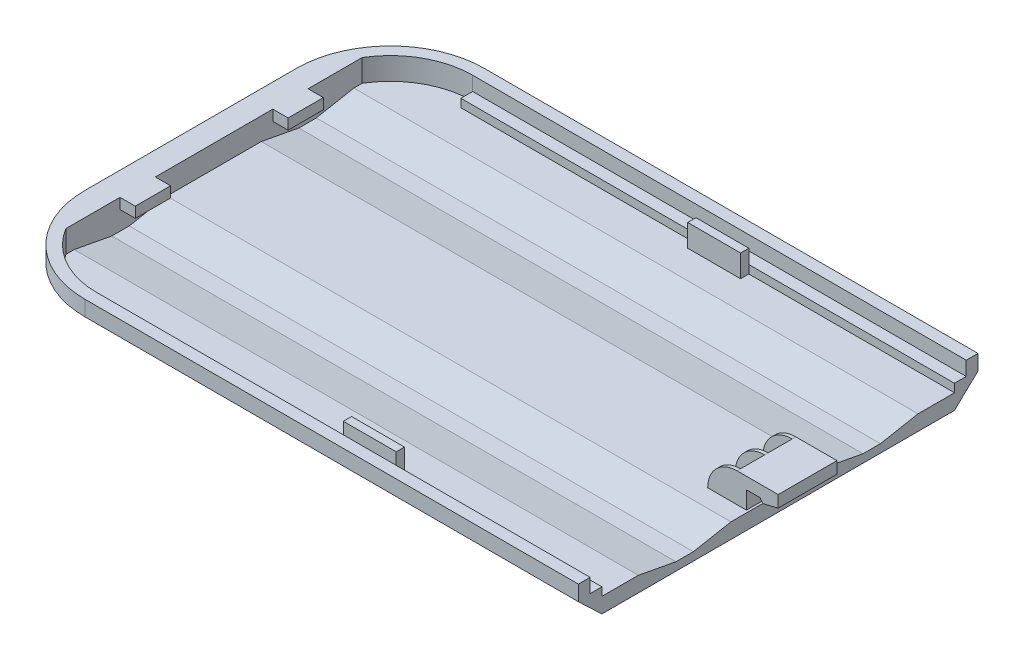
from build123d import *

# Parameters (mm, degrees)
BOSS_EXTRUDE1_DEPTH     = 42
SKETCH3_W               = 4.5
SKETCH3_H               = 0.7
BOSS_EXTRUDE2_DEPTH     = 1.899999
SKETCH6_W               = 2.500000024
SKETCH6_H               = 0.3
REVOLVE1_ANGLE          = 90
SKETCH7_W               = 2.7
SKETCH7_H               = 5
BOSS_EXTRUDE3_DEPTH     = 2.50000008
SKETCH9_W               = 3.499999976
SKETCH9_H               = 5
CUT_EXTRUDE1_DEPTH      = 1.50000008
SKETCH10_W              = 0.3
SKETCH10_H              = 5
REVOLVE2_ANGLE          = 90
BOSS_EXTRUDE5_START     = -5
BOSS_EXTRUDE5_DEPTH     = 5
REVOLVE4_ANGLE          = 90
REVOLVE6_ANGLE          = 90
BOSS_EXTRUDE7_DEPTH     = 18
BOSS_EXTRUDE8_DEPTH     = 2.9
CUT_EXTRUDE2_DEPTH      = 2.9
BOSS_EXTRUDE9_START     = -1.899999
BOSS_EXTRUDE9_DEPTH     = 1.899999
SKETCH29_W              = 3
SKETCH29_H              = 0.9
BOSS_EXTRUDE10_DEPTH    = 1.3
CUT_EXTRUDE3_START      = -3.1
CUT_EXTRUDE3_DEPTH      = 3.1
CUT_EXTRUDE4_START      = -44.9
CUT_EXTRUDE4_DEPTH      = 2.9
SKETCH34_W              = 0.799999976
SKETCH34_H              = 5
BOSS_EXTRUDE11_DEPTH    = 2.5
CUT_EXTRUDE5_DEPTH      = 53.947521022
CUT_EXTRUDE5_DEPTH_BACK = 12.7


with BuildPart() as part:
    # Sketch1 → Boss-Extrude1 (new body)
    with BuildSketch(Plane(origin=(0, 0, 0), x_dir=(0, 0, -1), z_dir=(1, 0, 0))):
        Polygon((-4.017828461, 1.2999976), (4.017828461, 1.2999976), (7.217828411, 0.69999753), (8.7, 0.69999753), (11.9, 1.2999976), (15, 1.2999976), (15, 1.9999962), (16, 1.9999962), (16, 3.1999962), (17, 3.1999962), (17, 1.8999962), (15, 0), (-15, 0), (-17, 1.8999962), (-17, 3.1999962), (-16, 3.1999962), (-16, 1.9999962), (-15, 1.9999962), (-15, 1.2999976), (-11.9, 1.2999976), (-8.7, 0.69999753), (-7.217828411, 0.69999753), align=None)
    extrude(amount=-BOSS_EXTRUDE1_DEPTH)

    # Sketch3 → Boss-Extrude2 (add)
    with BuildSketch(Plane(origin=(0, 1.2999976, 0), x_dir=(1, 0, 0), z_dir=(0, 1, 0))):
        with Locations((-19.75, 14.65)):
            Rectangle(SKETCH3_W, SKETCH3_H)
        with Locations((-19.75, -14.65)):
            Rectangle(SKETCH3_W, SKETCH3_H)
    extrude(amount=BOSS_EXTRUDE2_DEPTH)

    # Sketch6 → Revolve1 (revolve)
    with BuildSketch(Plane(origin=(0, 1.2999976, 0), x_dir=(1, 0, 0), z_dir=(0, 1, 0))):
        with Locations((-2.249999988, 2.35)):
            Rectangle(SKETCH6_W, SKETCH6_H)
        with Locations((-2.249999988, 0)):
            Rectangle(SKETCH6_W, SKETCH6_H)
        with Locations((-2.249999988, -2.35)):
            Rectangle(SKETCH6_W, SKETCH6_H)
    revolve(axis=Axis((-0.999999976, 1.2999976, -2.5), (0, 0, -1)), revolution_arc=REVOLVE1_ANGLE)

    # Sketch20 → Revolve4 (revolve)
    with BuildSketch(Plane.ZY.offset(42)):
        Polygon((17, 3.1999962), (17, 1.8999962), (15, 0), (9, 0), (9, 0.756247537), (11.9, 0.756247537), (11.9, 1.2999976), (15, 1.2999976), (16, 1.2999976), (16, 1.9999962), (16, 3.1999962), align=None)
    revolve(axis=Axis((-42, 0, 9), (0, -1, 0)), revolution_arc=REVOLVE4_ANGLE)

    # Sketch22 → Revolve6 (revolve)
    with BuildSketch(Plane.ZY.offset(42)):
        Polygon((-9, 0.756247537), (-9, 0), (-15, 0), (-17, 1.8999962), (-17, 3.1999962), (-16, 3.1999962), (-16, 1.9999962), (-16, 1.2999976), (-15, 1.2999976), (-11.9, 1.2999976), (-11.9, 0.756247537), align=None)
    revolve(axis=Axis((-42, 3.1999962, -9), (0, 1, 0)), revolution_arc=REVOLVE6_ANGLE)

    # Sketch25 → Boss-Extrude7 (add)
    with BuildSketch(Plane.XY.offset(-9)):
        Polygon((-42, 0), (-42, 0.756247537), (-44.9, 0.756247537), (-44.9, 1.2999976), (-49, 1.2999976), (-49, 3.1999962), (-50, 3.1999962), (-50, 1.8999962), (-48, 0), align=None)
    extrude(amount=BOSS_EXTRUDE7_DEPTH)

    # Sketch26 → Boss-Extrude8 (add)
    with BuildSketch(Plane.ZY.offset(42)):
        Polygon((11.9, 0.756247537), (11.9, 1.2999976), (9, 0.756247537), align=None)
        Polygon((6.917828416, 0.756247537), (4.017828461, 1.2999976), (-4.017828461, 1.2999976), (-7.067828413, 0.728122533), align=None)
        Polygon((-9, 0.756247537), (-11.9, 1.2999976), (-11.9, 0.756247537), align=None)
    extrude(amount=BOSS_EXTRUDE8_DEPTH)

    # Sketch27 → Cut-Extrude2 (cut)
    with BuildSketch(Plane(origin=(-42, 0, 0), x_dir=(0, 0, -1), z_dir=(1, 0, 0))):
        Polygon((-8.7, 0.69999753), (-7.217828411, 0.69999753), (-6.917828416, 0.756247537), (-9, 0.756247537), align=None)
        Polygon((8.7, 0.69999753), (9, 0.756247537), (6.917828416, 0.756247537), (7.217828416, 0.69999753), align=None)
    extrude(amount=-CUT_EXTRUDE2_DEPTH, mode=Mode.SUBTRACT)

    # Sketch28 → Boss-Extrude9 (add)
    with BuildSketch(Plane(origin=(0, 3.1999962, 0), x_dir=(1, 0, 0), z_dir=(0, 1, 0)).offset(BOSS_EXTRUDE9_START)):
        Polygon((-48, 12.605551275), (-48, -12.605551275), (-48.526031835, -12.605551275), (-49.587841203, -9.896604303), (-49.587841203, 5.333499325), (-49.587841203, 9.659559889), (-49.052063671, 11.553487605), align=None)
    extrude(amount=BOSS_EXTRUDE9_DEPTH)

    # Sketch29 → Boss-Extrude10 (add)
    with BuildSketch(Plane(origin=(-48, 0, 0), x_dir=(0, 0, -1), z_dir=(1, 0, 0))):
        with Locations((6.5, 2.7499962)):
            Rectangle(SKETCH29_W, SKETCH29_H)
        with Locations((-6.5, 2.7499962)):
            Rectangle(SKETCH29_W, SKETCH29_H)
    extrude(amount=BOSS_EXTRUDE10_DEPTH)

    # Sketch31 → Cut-Extrude3 (cut)
    with BuildSketch(Plane(origin=(-44.9, 0, 0), x_dir=(0, 0, -1), z_dir=(1, 0, 0)).offset(CUT_EXTRUDE3_START)):
        Polygon((-8.7, 0.69999753), (-7.217828411, 0.69999753), (-4.017828461, 1.2999976), (-9, 1.2999976), (-11.9, 1.2999976), align=None)
        Polygon((4.017828461, 1.2999976), (7.217828416, 0.69999753), (8.7, 0.69999753), (11.9, 1.2999976), align=None)
    extrude(amount=CUT_EXTRUDE3_DEPTH, mode=Mode.SUBTRACT)

    # Sketch33 → Cut-Extrude4 (cut)
    with BuildSketch(Plane(origin=(0, 0, 0), x_dir=(0, 0, -1), z_dir=(1, 0, 0)).offset(CUT_EXTRUDE4_START)):
        Polygon((-11.9, 1.2999976), (-4.017828461, 1.2999976), (-7.217828411, 0.69999753), (-8.7, 0.69999753), align=None)
        Polygon((4.017828461, 1.2999976), (11.9, 1.2999976), (8.7, 0.69999753), (7.272372627, 0.69999753), align=None)
    extrude(amount=CUT_EXTRUDE4_DEPTH, mode=Mode.SUBTRACT)



with BuildPart() as body_2:
    # Sketch7 → Boss-Extrude3 (new body)
    with BuildSketch(Plane(origin=(1.692653476, 1.2999976, 1.325896357), x_dir=(1, 0, 0), z_dir=(0, 1, 0))):
        with Locations((-0.542653476, 1.325896357)):
            Rectangle(SKETCH7_W, SKETCH7_H)
    extrude(amount=BOSS_EXTRUDE3_DEPTH)

    # Sketch9 → Cut-Extrude1 (cut)
    with BuildSketch(Plane.XZ.offset(-1.2999976)):
        with Locations((0.750000012, 0)):
            Rectangle(SKETCH9_W, SKETCH9_H)
    extrude(amount=-CUT_EXTRUDE1_DEPTH, mode=Mode.SUBTRACT)

    # Sketch10 → Revolve2 (revolve)
    with BuildSketch(Plane.XZ.offset(-2.79999768)):
        with Locations((1.15, 0)):
            Rectangle(SKETCH10_W, SKETCH10_H)
    revolve(axis=Axis((1.3, 2.79999768, 2.5), (0, 0, 1)), revolution_arc=REVOLVE2_ANGLE)

    # Sketch11 → Boss-Extrude5 (add)
    with BuildSketch(Plane(origin=(0, 0, -2.5), x_dir=(-1, 0, 0), z_dir=(0, 0, -1)).offset(BOSS_EXTRUDE5_START)):
        Polygon((-1.3, 2.49999768), (-2.5, 2.79999768), (-1.3, 2.79999768), align=None)
    extrude(amount=BOSS_EXTRUDE5_DEPTH)


with BuildPart() as part_1:
    add(part.part)

    add(body_2.part)  # Boss-Extrude11 merges body 2
    # Sketch34 → Boss-Extrude11 (add)
    with BuildSketch(Plane(origin=(0, 1.2999976, 0), x_dir=(1, 0, 0), z_dir=(0, 1, 0))):
        with Locations((-0.599999988, 0)):
            Rectangle(SKETCH34_W, SKETCH34_H)
    extrude(amount=BOSS_EXTRUDE11_DEPTH)

    # Sketch36 → Cut-Extrude5 (cut, two sides: drawn at the far end of the back side and taken through both)
    with BuildSketch(Plane.XY.offset(-CUT_EXTRUDE5_DEPTH_BACK)):
        Polygon((-50, 1.8999962), (-48, 0), (-50, 0), align=None)
    extrude(amount=CUT_EXTRUDE5_DEPTH + CUT_EXTRUDE5_DEPTH_BACK, mode=Mode.SUBTRACT)


solid = part_1.part
